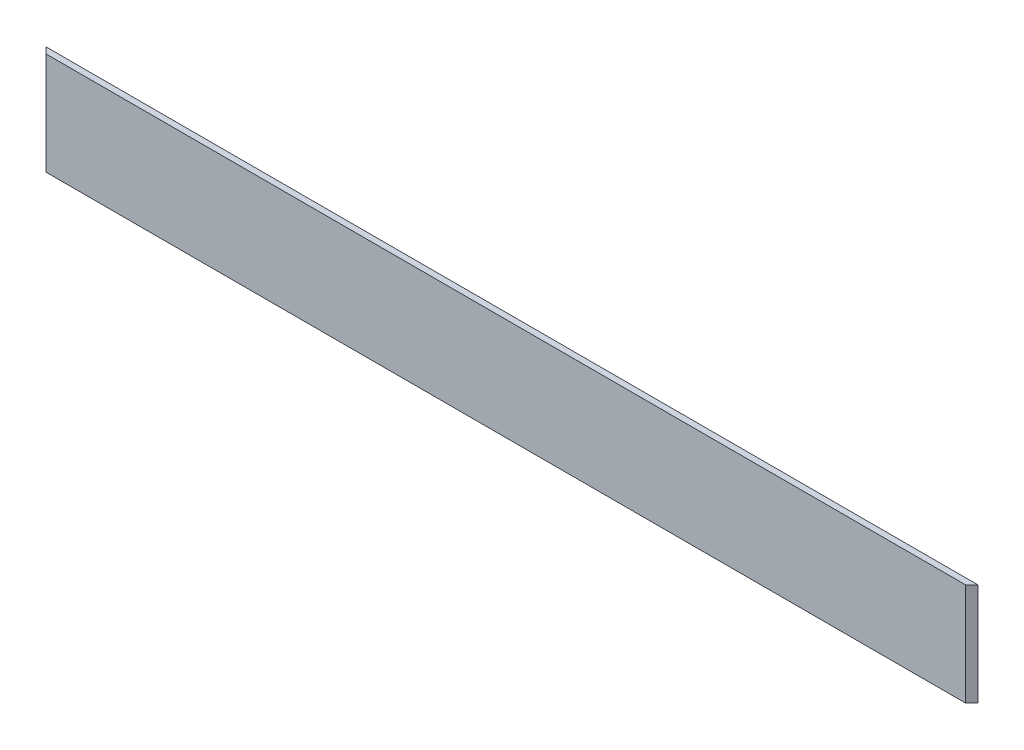
from build123d import *

# Parameters (mm, degrees)
SKETCH1_W           = 455
SKETCH1_H           = 3
BOSS_EXTRUDE1_DEPTH = 50
CUT_EXTRUDE1_DEPTH  = 233.934540161


with BuildPart() as part:
    # Sketch1 → Boss-Extrude1 (new body)
    with BuildSketch(Plane(origin=(0, 0, 0), x_dir=(1, 0, 0), z_dir=(0, 1, 0))):
        Rectangle(SKETCH1_W, SKETCH1_H)
    extrude(amount=BOSS_EXTRUDE1_DEPTH)

    # Sketch2 → Cut-Extrude1 (cut, through all)
    with BuildSketch(Plane(origin=(0, 50, 0), x_dir=(1, 0, 0), z_dir=(0, 1, 0))):
        Polygon((-227.5, 1.5), (-227.5, -1.5), (-224.5, -1.5), align=None)
        Polygon((227.5, -1.5), (227.5, 1.5), (224.5, -1.5), align=None)
    extrude(amount=-CUT_EXTRUDE1_DEPTH, mode=Mode.SUBTRACT)


solid = part.part
